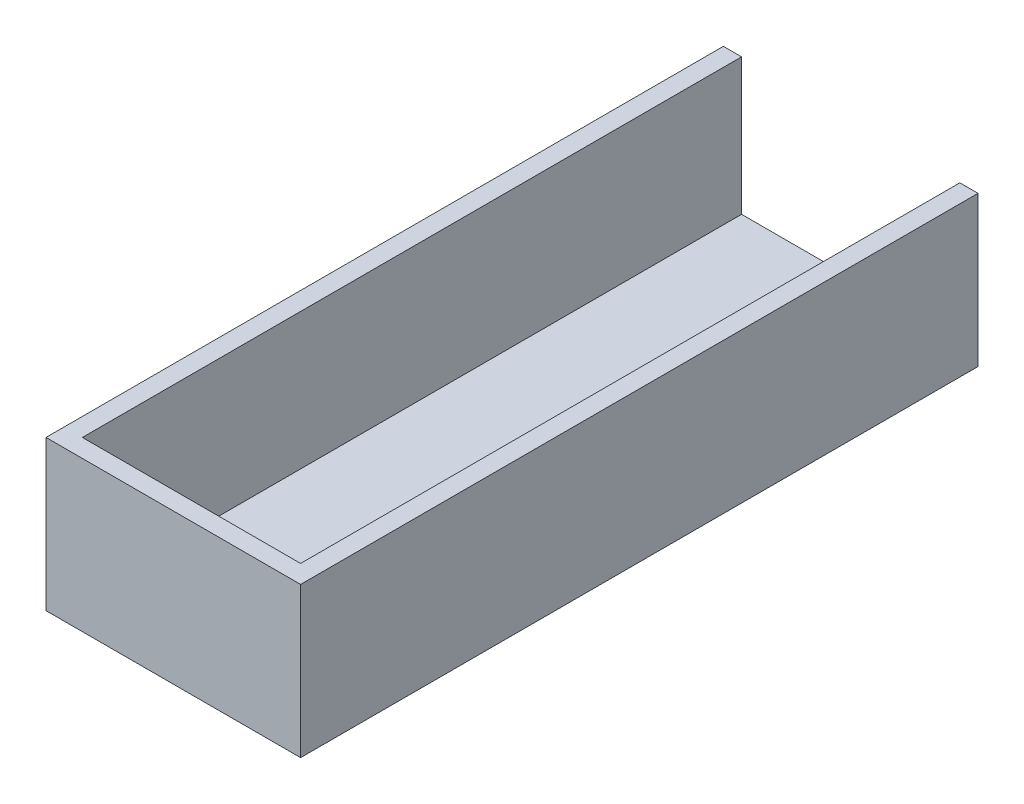
from build123d import *

# Parameters (mm, degrees)
CROQUIS1_W              = 56
CROQUIS1_H              = 149
SALIENTE_EXTRUIR4_DEPTH = 33
CROQUIS2_W              = 48
CROQUIS2_H              = 145
CORTAR_EXTRUIR1_DEPTH   = 30


with BuildPart() as part:
    # Croquis1 → Saliente-Extruir4 (new body)
    with BuildSketch(Plane(origin=(0, 0, 0), x_dir=(1, 0, 0), z_dir=(0, 1, 0))):
        Rectangle(CROQUIS1_W, CROQUIS1_H)
    extrude(amount=SALIENTE_EXTRUIR4_DEPTH)

    # Croquis2 → Cortar-Extruir1 (cut)
    with BuildSketch(Plane(origin=(0, 33, 0), x_dir=(1, 0, 0), z_dir=(0, 1, 0))):
        with Locations((0, 2)):
            Rectangle(CROQUIS2_W, CROQUIS2_H)
    extrude(amount=-CORTAR_EXTRUIR1_DEPTH, mode=Mode.SUBTRACT)


solid = part.part
